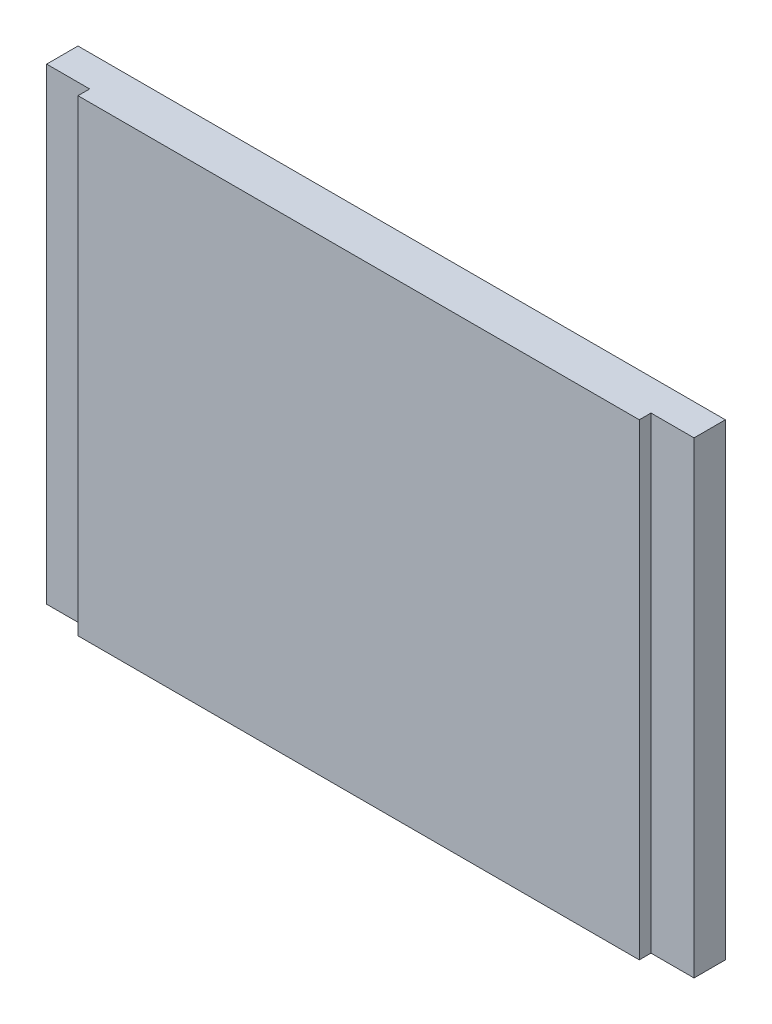
from build123d import *

# Parameters (mm, degrees)
SKETCH1_W           = 87.884
SKETCH1_H           = 63.5
BOSS_EXTRUDE1_DEPTH = 5.842
SKETCH2_W           = 5.842
SKETCH2_H           = 63.5
CUT_EXTRUDE1_DEPTH  = 1.5875


with BuildPart() as part:
    # Sketch1 → Boss-Extrude1 (new body)
    with BuildSketch(Plane.XY):
        with Locations((43.942, 31.75)):
            Rectangle(SKETCH1_W, SKETCH1_H)
    extrude(amount=BOSS_EXTRUDE1_DEPTH)

    # Sketch2 → Cut-Extrude1 (cut)
    with BuildSketch(Plane.XY.offset(5.842)):
        with Locations((2.921, 31.75)):
            Rectangle(SKETCH2_W, SKETCH2_H)
        with Locations((84.963, 31.75)):
            Rectangle(SKETCH2_W, SKETCH2_H)
    extrude(amount=-CUT_EXTRUDE1_DEPTH, mode=Mode.SUBTRACT)


solid = part.part
